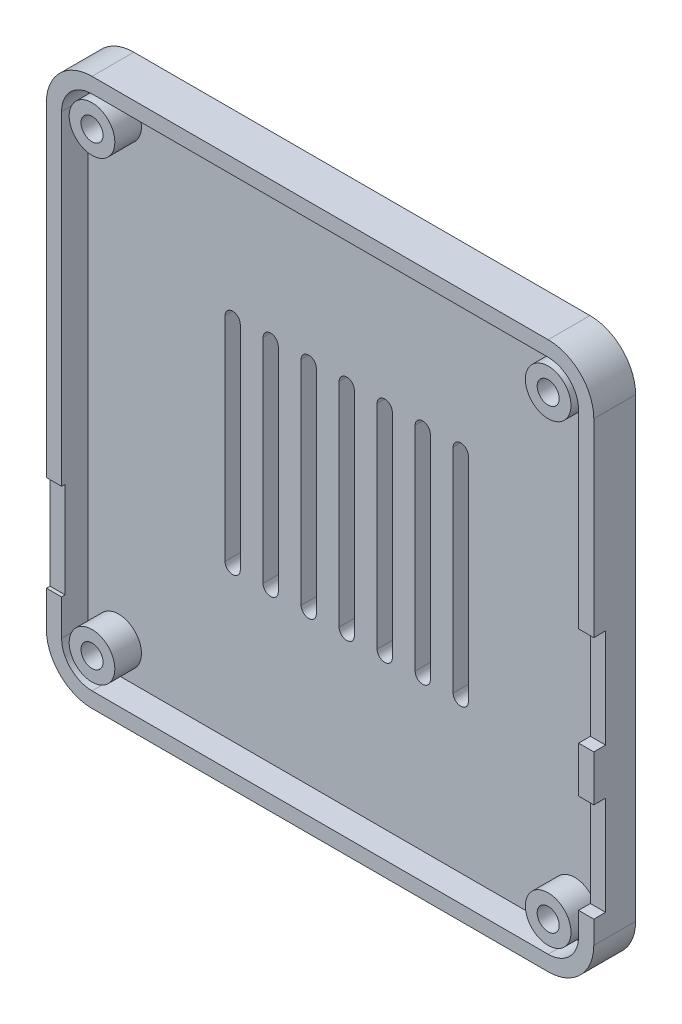
from build123d import *

# Parameters (mm, degrees)
BOSS_EXTRUDE1_DEPTH = 5.5
CUT_EXTRUDE1_DEPTH  = 3.5
SKETCH3_R           = 3
BOSS_EXTRUDE2_DEPTH = 3.5
SKETCH4_R           = 1.45
CUT_EXTRUDE2_DEPTH  = 5.5
SKETCH5_R           = 2.5
CUT_EXTRUDE3_DEPTH  = 2.6
CUT_EXTRUDE4_DEPTH  = 2
SKETCH7_W           = 3.5
SKETCH7_H           = 13.01
CUT_EXTRUDE5_DEPTH  = 1.55
SKETCH8_W           = 3.5
SKETCH8_H           = 12.6
CUT_EXTRUDE6_DEPTH  = 0.465


with BuildPart() as part:
    # Sketch1 → Boss-Extrude1 (new body)
    with BuildSketch(Plane.XY.offset(-5.5)):
        with BuildLine():
            Line((-30, -36), (30, -36))
            ThreePointArc((30, -36), (34.242640687, -34.242640687), (36, -30))
            Line((36, -30), (36, 30))
            ThreePointArc((36, 30), (34.242640687, 34.242640687), (30, 36))
            Line((30, 36), (-30, 36))
            ThreePointArc((-30, 36), (-34.242640687, 34.242640687), (-36, 30))
            Line((-36, 30), (-36, -30))
            ThreePointArc((-36, -30), (-34.242640687, -34.242640687), (-30, -36))
        make_face()
    extrude(amount=BOSS_EXTRUDE1_DEPTH)

    # Sketch2 → Cut-Extrude1 (cut)
    with BuildSketch(Plane.XY.offset(-3.5)):
        with BuildLine():
            Line((-30, -34), (30, -34))
            ThreePointArc((30, -34), (32.828427125, -32.828427125), (34, -30))
            Line((34, -30), (34, 30))
            ThreePointArc((34, 30), (32.828427125, 32.828427125), (30, 34))
            Line((30, 34), (-30, 34))
            ThreePointArc((-30, 34), (-32.828427125, 32.828427125), (-34, 30))
            Line((-34, 30), (-34, -30))
            ThreePointArc((-34, -30), (-32.828427125, -32.828427125), (-30, -34))
        make_face()
    extrude(amount=CUT_EXTRUDE1_DEPTH, mode=Mode.SUBTRACT)

    # Sketch3 → Boss-Extrude2 (add)
    with BuildSketch(Plane.XY.offset(-3.5)):
        with Locations((-30, 30)):
            Circle(SKETCH3_R)
        with Locations((30, 30)):
            Circle(SKETCH3_R)
        with Locations((-30, -30)):
            Circle(SKETCH3_R)
        with Locations((30, -30)):
            Circle(SKETCH3_R)
    extrude(amount=BOSS_EXTRUDE2_DEPTH)

    # Sketch4 → Cut-Extrude2 (cut)
    with BuildSketch(Plane.XY.offset(-5.5)):
        with Locations((-30, 30)):
            Circle(SKETCH4_R)
        with Locations((30, 30)):
            Circle(SKETCH4_R)
        with Locations((-30, -30)):
            Circle(SKETCH4_R)
        with Locations((30, -30)):
            Circle(SKETCH4_R)
    extrude(amount=CUT_EXTRUDE2_DEPTH, mode=Mode.SUBTRACT)

    # Sketch5 → Cut-Extrude3 (cut)
    with BuildSketch(Plane.XY.offset(-5.5)):
        with Locations((-30, 30)):
            Circle(SKETCH5_R)
        with Locations((30, 30)):
            Circle(SKETCH5_R)
        with Locations((-30, -30)):
            Circle(SKETCH5_R)
        with Locations((30, -30)):
            Circle(SKETCH5_R)
    extrude(amount=CUT_EXTRUDE3_DEPTH, mode=Mode.SUBTRACT)

    # Sketch6 → Cut-Extrude4 (cut)
    with BuildSketch(Plane.XY.offset(-5.5)):
        with BuildLine():
            Line((-16, -14), (-16, 14))
            ThreePointArc((-16, 14), (-15, 15), (-14, 14))
            Line((-14, 14), (-14, -14))
            ThreePointArc((-14, -14), (-15, -15), (-16, -14))
        make_face()
        with BuildLine():
            Line((-11, -14), (-11, 14))
            ThreePointArc((-11, 14), (-10, 15), (-9, 14))
            Line((-9, 14), (-9, -14))
            ThreePointArc((-9, -14), (-10, -15), (-11, -14))
        make_face()
        with BuildLine():
            Line((-6, -14), (-6, 14))
            ThreePointArc((-6, 14), (-5, 15), (-4, 14))
            Line((-4, 14), (-4, -14))
            ThreePointArc((-4, -14), (-5, -15), (-6, -14))
        make_face()
        with BuildLine():
            Line((-1, -14), (-1, 14))
            ThreePointArc((-1, 14), (0, 15), (1, 14))
            Line((1, 14), (1, -14))
            ThreePointArc((1, -14), (0, -15), (-1, -14))
        make_face()
        with BuildLine():
            Line((4, -14), (4, 14))
            ThreePointArc((4, 14), (5, 15), (6, 14))
            Line((6, 14), (6, -14))
            ThreePointArc((6, -14), (5, -15), (4, -14))
        make_face()
        with BuildLine():
            Line((9, -14), (9, 14))
            ThreePointArc((9, 14), (10, 15), (11, 14))
            Line((11, 14), (11, -14))
            ThreePointArc((11, -14), (10, -15), (9, -14))
        make_face()
        with BuildLine():
            Line((14, -14), (14, 14))
            ThreePointArc((14, 14), (15, 15), (16, 14))
            Line((16, 14), (16, -14))
            ThreePointArc((16, -14), (15, -15), (14, -14))
        make_face()
    extrude(amount=CUT_EXTRUDE4_DEPTH, mode=Mode.SUBTRACT)

    # Sketch7 → Cut-Extrude5 (cut)
    with BuildSketch(Plane.XY.offset(-1.55)):
        with Locations((35.25, -1.445)):
            Rectangle(SKETCH7_W, SKETCH7_H)
        with Locations((35.25, -20.495)):
            Rectangle(SKETCH7_W, SKETCH7_H)
    extrude(amount=CUT_EXTRUDE5_DEPTH, mode=Mode.SUBTRACT)

    # Sketch8 → Cut-Extrude6 (cut)
    with BuildSketch(Plane.XY.offset(-0.465)):
        with Locations((-35.25, -19)):
            Rectangle(SKETCH8_W, SKETCH8_H)
    extrude(amount=CUT_EXTRUDE6_DEPTH, mode=Mode.SUBTRACT)


solid = part.part
